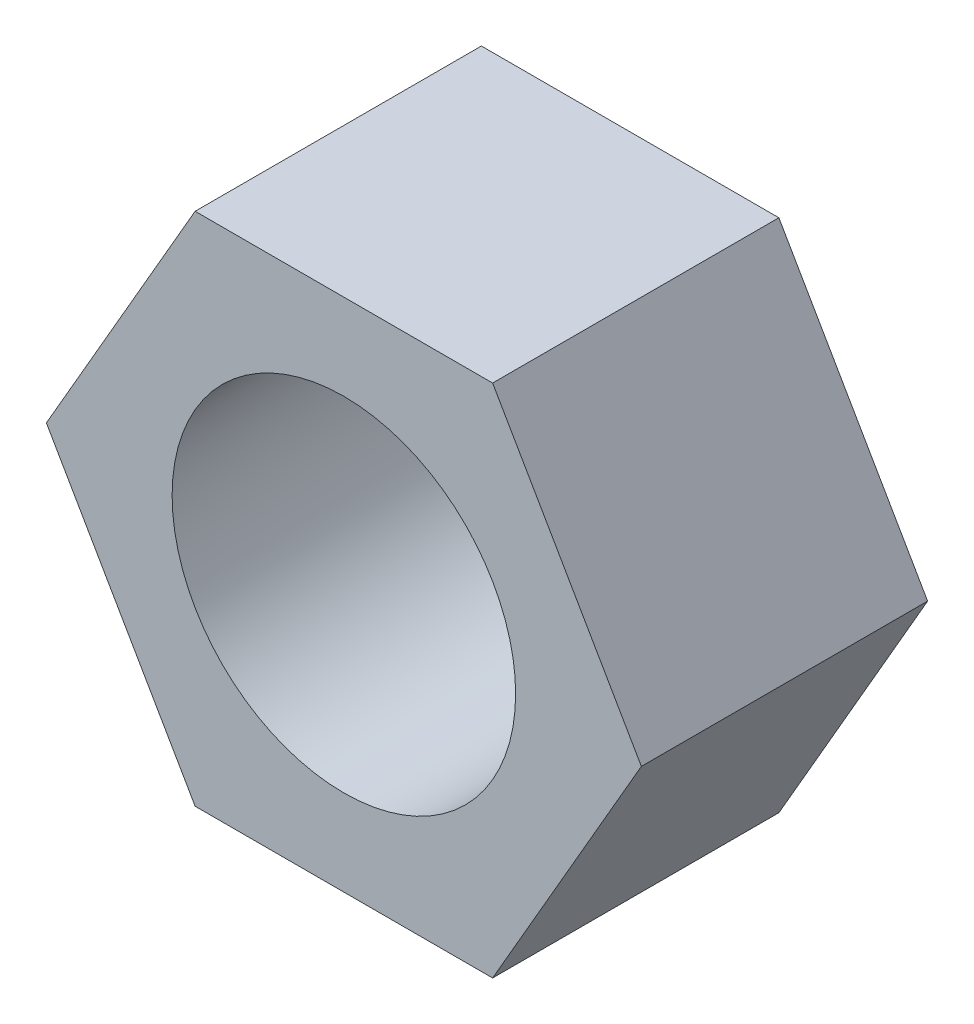
from build123d import *

# Parameters (mm, degrees)
SKETCH_1_R      = 3
EXTRUDE_1_DEPTH = 5


with BuildPart() as part:
    # 스케치1 → 보스-돌출1 (new body)
    with BuildSketch(Plane.XY):
        Polygon((2.598076211, -4.5), (5.196152423, 0), (2.598076211, 4.5), (-2.598076211, 4.5), (-5.196152423, 0), (-2.598076211, -4.5), align=None)
        Circle(SKETCH_1_R, mode=Mode.SUBTRACT)
    extrude(amount=EXTRUDE_1_DEPTH)


solid = part.part
